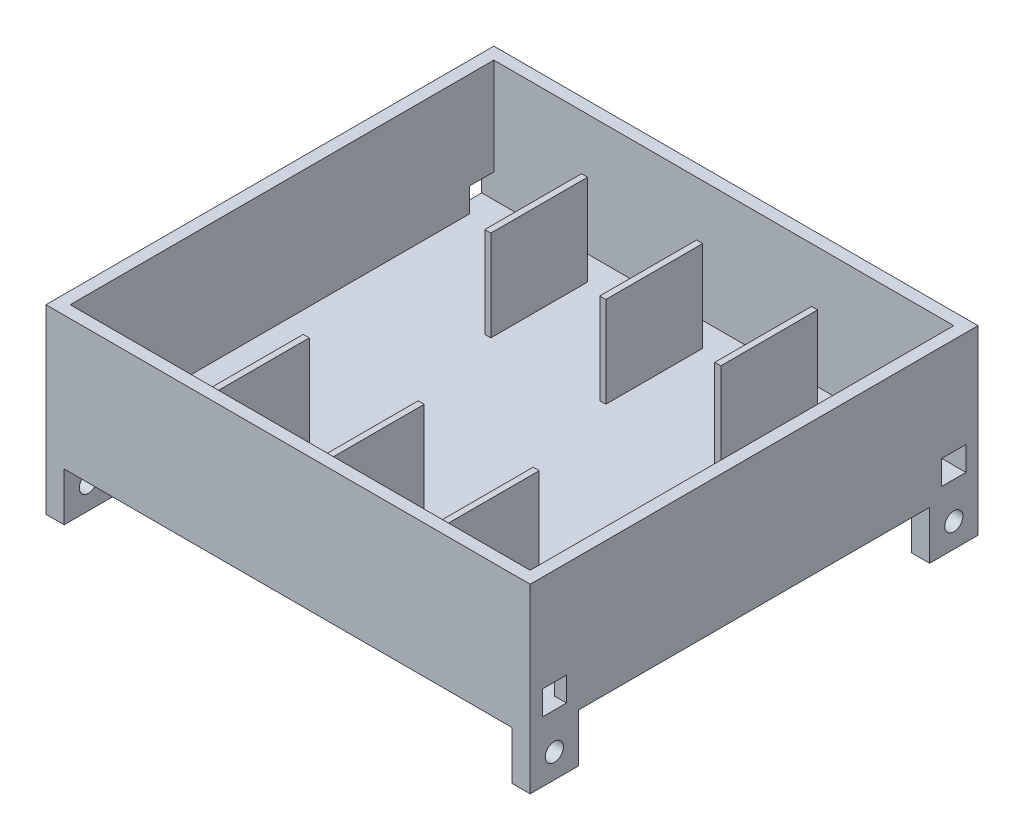
from build123d import *

# Parameters (mm, degrees)
SKETCH_1_W          = 80
SKETCH_1_H          = 74
EXTRUDE_1_DEPTH     = 2
SKETCH_2_W          = 80
SKETCH_2_H          = 74
SKETCH_2_W_2        = 76
SKETCH_2_H_2        = 70
EXTRUDE_2_DEPTH     = 20
SKETCH_3_W          = 2
SKETCH_3_H          = 4
CUT_EXTRUDE_3_DEPTH = 4
SKETCH_4_W          = 1
SKETCH_4_H          = 16
SKETCH_4_H_2        = 20
EXTRUDE_3_DEPTH     = 15
SKETCH_6_W          = 3
SKETCH_6_H          = 8
EXTRUDE_4_DEPTH     = 8
SKETCH_7_R          = 1.5
CUT_EXTRUDE_5_DEPTH = 91.846023578


with BuildPart() as part:
    # Эскиз1 → Бобышка-Вытянуть1 (new body)
    with BuildSketch(Plane(origin=(0, 0, 0), x_dir=(1, 0, 0), z_dir=(0, 1, 0))):
        Rectangle(SKETCH_1_W, SKETCH_1_H)
    extrude(amount=EXTRUDE_1_DEPTH)

    # Эскиз2 → Бобышка-Вытянуть2 (add)
    with BuildSketch(Plane(origin=(0, 2, 0), x_dir=(1, 0, 0), z_dir=(0, 1, 0))):
        Rectangle(SKETCH_2_W, SKETCH_2_H)
        Rectangle(SKETCH_2_W_2, SKETCH_2_H_2, mode=Mode.SUBTRACT)
    extrude(amount=EXTRUDE_2_DEPTH)

    # Эскиз3 → Вырез-Вытянуть3 (cut)
    with BuildSketch(Plane(origin=(0, 2, 0), x_dir=(1, 0, 0), z_dir=(0, 1, 0))):
        with Locations((-39, 33)):
            Rectangle(SKETCH_3_W, SKETCH_3_H)
        with Locations((39, 33)):
            Rectangle(SKETCH_3_W, SKETCH_3_H)
        with Locations((39, -33)):
            Rectangle(SKETCH_3_W, SKETCH_3_H)
        with Locations((-39, -33)):
            Rectangle(SKETCH_3_W, SKETCH_3_H)
    extrude(amount=CUT_EXTRUDE_3_DEPTH, mode=Mode.SUBTRACT)

    # Эскиз4 → Бобышка-Вытянуть3 (add)
    with BuildSketch(Plane(origin=(0, 2, 0), x_dir=(1, 0, 0), z_dir=(0, 1, 0))):
        with Locations((-19, 23)):
            Rectangle(SKETCH_4_W, SKETCH_4_H)
        with Locations((0, 23)):
            Rectangle(SKETCH_4_W, SKETCH_4_H)
        with Locations((19, 23)):
            Rectangle(SKETCH_4_W, SKETCH_4_H)
        with Locations((-19, -23)):
            Rectangle(SKETCH_4_W, SKETCH_4_H)
        with Locations((0, -23)):
            Rectangle(SKETCH_4_W, SKETCH_4_H)
        with Locations((19, -25)):
            Rectangle(SKETCH_4_W, SKETCH_4_H_2)
    extrude(amount=EXTRUDE_3_DEPTH)

    # Эскиз6 → Бобышка-Вытянуть4 (add)
    with BuildSketch(Plane.XZ):
        with Locations((38.5, 33)):
            Rectangle(SKETCH_6_W, SKETCH_6_H)
        with Locations((38.5, -33)):
            Rectangle(SKETCH_6_W, SKETCH_6_H)
        with Locations((-38.5, -33)):
            Rectangle(SKETCH_6_W, SKETCH_6_H)
        with Locations((-38.5, 33)):
            Rectangle(SKETCH_6_W, SKETCH_6_H)
    extrude(amount=EXTRUDE_4_DEPTH)

    # Эскиз7 → Вырез-Вытянуть5 (cut, through all)
    with BuildSketch(Plane.ZY.offset(40)):
        with Locations((33, -4)):
            Circle(SKETCH_7_R)
        with Locations((-33, -4)):
            Circle(SKETCH_7_R)
    extrude(amount=-CUT_EXTRUDE_5_DEPTH, mode=Mode.SUBTRACT)


solid = part.part
